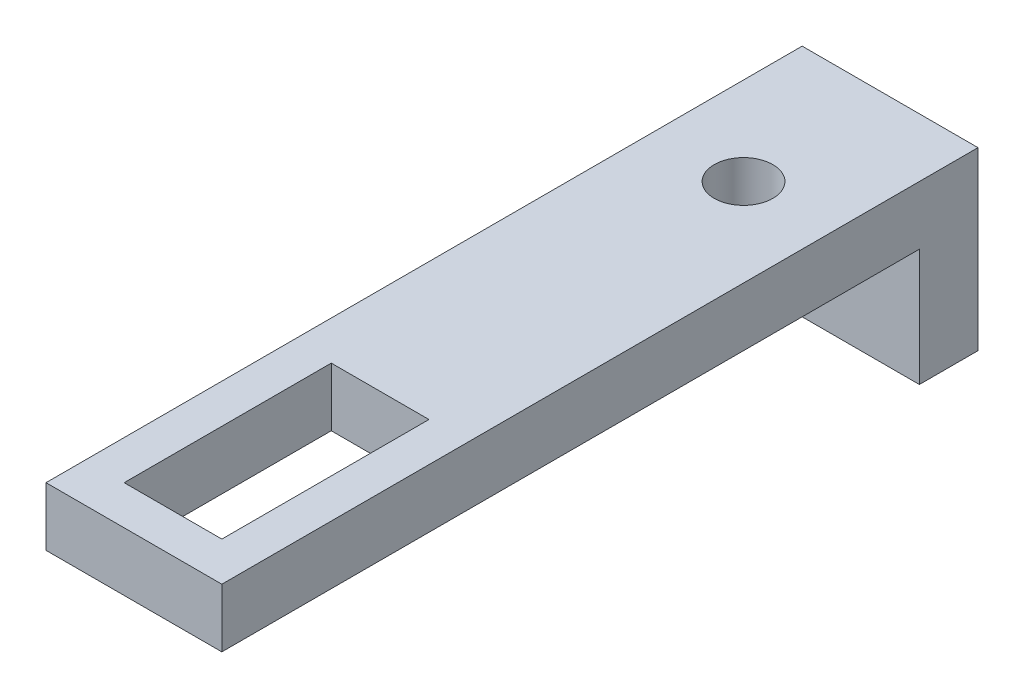
from build123d import *

# Parameters (mm, degrees)
SKETCH1_W           = 9
SKETCH1_H           = 35.7
SKETCH1_R           = 1.5
BOSS_EXTRUDE1_DEPTH = 3
SKETCH2_W           = 9
SKETCH2_H           = 3
BOSS_EXTRUDE2_DEPTH = 9


with BuildPart() as part:
    # Sketch1 → Boss-Extrude1 (new body)
    with BuildSketch(Plane(origin=(0, 0, 0), x_dir=(1, 0, 0), z_dir=(0, 1, 0))):
        with Locations((-4.5, -17.85)):
            Rectangle(SKETCH1_W, SKETCH1_H)
        with Locations(Location((-4.5, -4.5, 0), (0, 0, 270))):
            Circle(SKETCH1_R, mode=Mode.SUBTRACT)
        Polygon((-7, -32.7), (-7, -33.7), (-2, -33.7), (-2, -32.7), (-2, -23.1), (-7, -23.1), align=None, mode=Mode.SUBTRACT)
    extrude(amount=BOSS_EXTRUDE1_DEPTH)

    # Sketch2 → Boss-Extrude2 (add)
    with BuildSketch(Plane(origin=(0, 3, 0), x_dir=(1, 0, 0), z_dir=(0, 1, 0))):
        with Locations((-4.5, 1.5)):
            Rectangle(SKETCH2_W, SKETCH2_H)
    extrude(amount=-BOSS_EXTRUDE2_DEPTH)


solid = part.part
